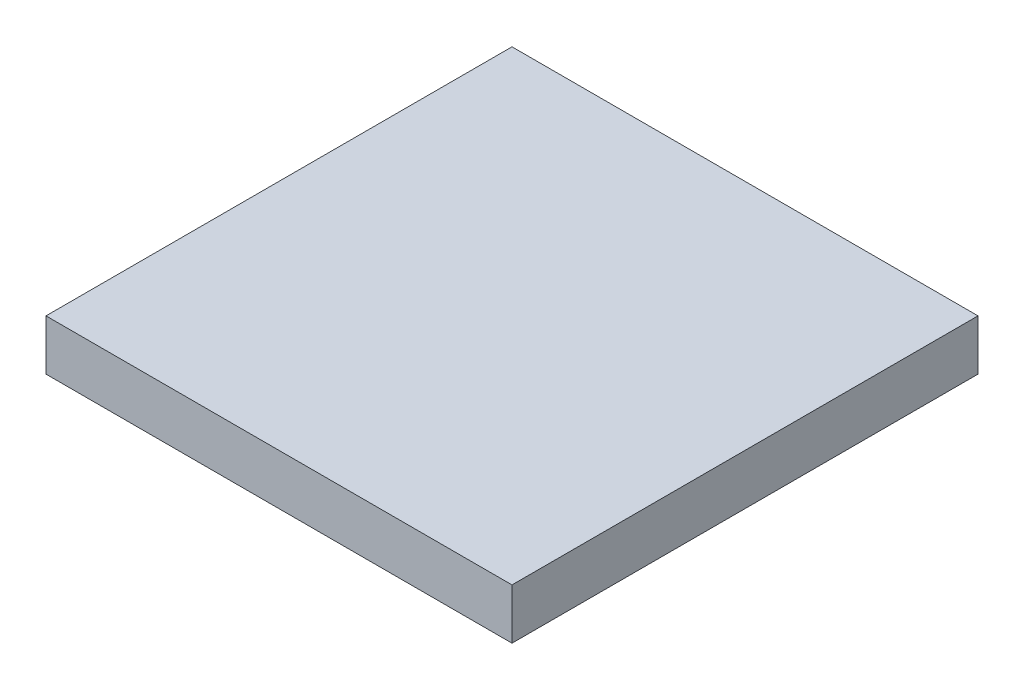
from build123d import *

# Parameters (mm, degrees)
MTG_MONTAJ_BRAKETI_3MM_1_START = 30
SKETCH1_W                      = 60
SKETCH1_H                      = 6.5
MTG_MONTAJ_BRAKETI_3MM_1_DEPTH = 60


with BuildPart() as part:
    # Sketch1 → MTG_montaj_braketi_3mm_1 (new body)
    with BuildSketch(Plane.XY.offset(MTG_MONTAJ_BRAKETI_3MM_1_START)):
        with Locations((30, -21.75)):
            Rectangle(SKETCH1_W, SKETCH1_H)
    extrude(amount=-MTG_MONTAJ_BRAKETI_3MM_1_DEPTH)


solid = part.part
